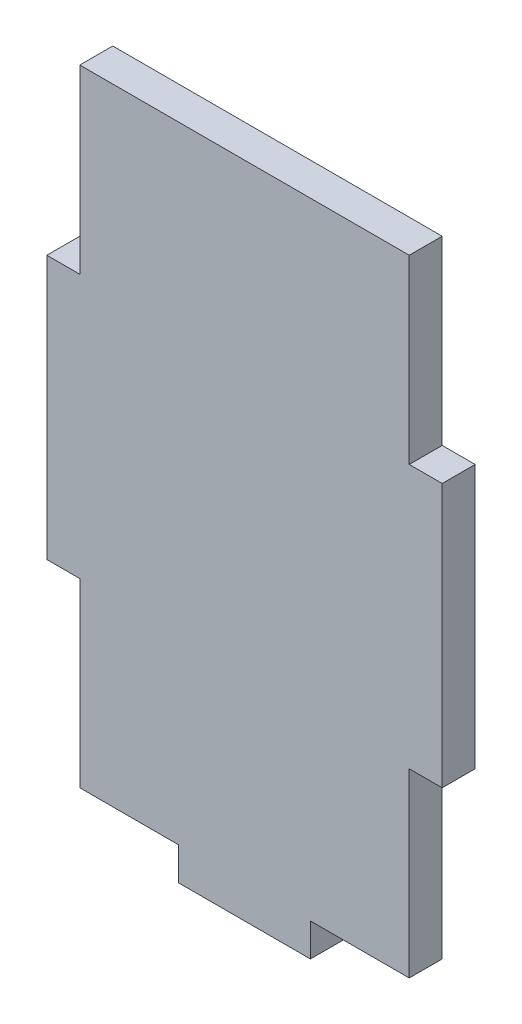
from build123d import *

# Parameters (mm, degrees)
BOSS_EXTRUDE1_DEPTH = 3.175


with BuildPart() as part:
    # Sketch1 → Boss-Extrude1 (new, symmetric)
    with BuildSketch(Plane.XY):
        Polygon((-31.75, -25.4), (-31.75, -60.325), (-12.7, -60.325), (-12.7, -66.675), (12.7, -66.675), (12.7, -60.325), (31.75, -60.325), (31.75, -25.4), (38.1, -25.4), (38.1, 25.4), (31.75, 25.4), (31.75, 60.325), (-31.75, 60.325), (-31.75, 25.4), (-38.1, 25.4), (-38.1, -25.4), align=None)
    extrude(amount=BOSS_EXTRUDE1_DEPTH, both=True)


solid = part.part
